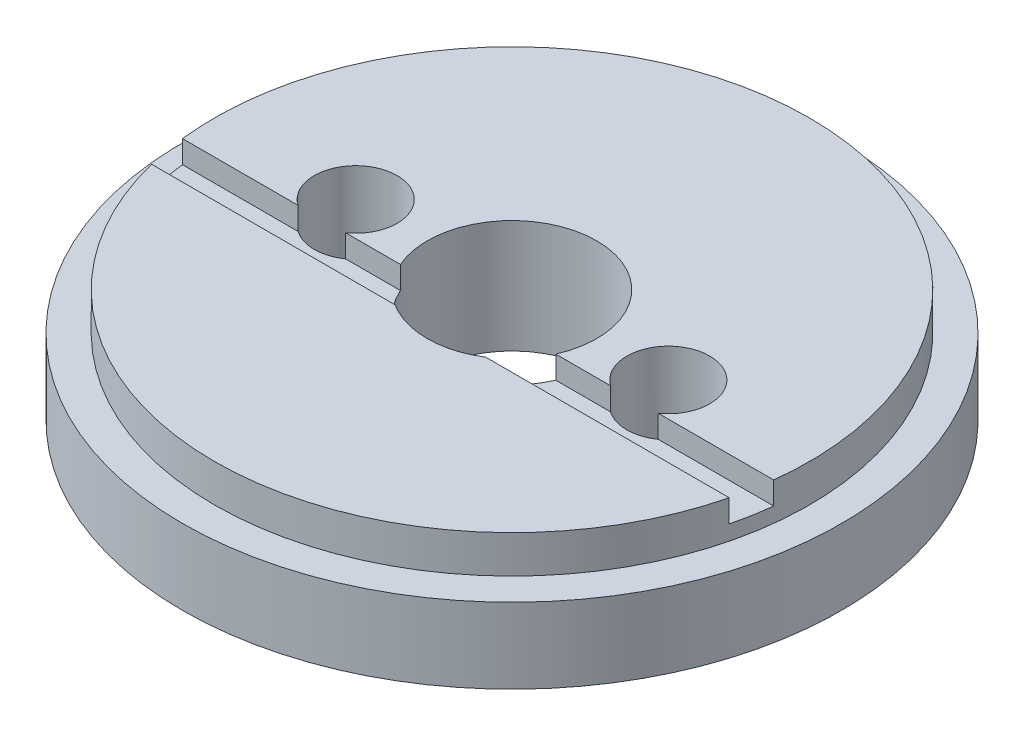
from build123d import *

# Parameters (mm, degrees)
SKETCH2_R           = 17.5
SKETCH2_R_2         = 4.5
SKETCH2_R_3         = 2.2
BOSS_EXTRUDE2_DEPTH = 6
SKETCH3_OUTSIDE_W   = 46.972
SKETCH3_OUTSIDE_H   = 46.972
SKETCH3_OUTSIDE_R   = 15.8
CUT_EXTRUDE1_DEPTH  = 2
CUT_EXTRUDE3_START  = -1.2
CUT_EXTRUDE3_DEPTH  = 1.2


with BuildPart() as part:
    # Sketch2 → Boss-Extrude2 (new body)
    with BuildSketch(Plane(origin=(0, 0, 0), x_dir=(1, 0, 0), z_dir=(0, 1, 0))):
        with Locations(Location((0, 0, 0), (0, 0, 270))):
            Circle(SKETCH2_R)
        with Locations(Location((0, 0, 0), (0, 0, 270))):
            Circle(SKETCH2_R_2, mode=Mode.SUBTRACT)
        with Locations(Location((-8.3, 0, 0), (0, 0, 270))):
            Circle(SKETCH2_R_3, mode=Mode.SUBTRACT)
        with Locations(Location((8.3, 0, 0), (0, 0, 90))):
            Circle(SKETCH2_R_3, mode=Mode.SUBTRACT)
    extrude(amount=BOSS_EXTRUDE2_DEPTH)

    # Sketch3 outside → Cut-Extrude1 (cut)
    with BuildSketch(Plane(origin=(0, 6, 0), x_dir=(1, 0, 0), z_dir=(0, 1, 0))):
        Rectangle(SKETCH3_OUTSIDE_W, SKETCH3_OUTSIDE_H)
        with Locations(Location((0, 0, 0), (0, 0, 270))):
            Circle(SKETCH3_OUTSIDE_R, mode=Mode.SUBTRACT)
    extrude(amount=-CUT_EXTRUDE1_DEPTH, mode=Mode.SUBTRACT)

    # Sketch4 → Cut-Extrude3 (cut)
    with BuildSketch(Plane(origin=(0, 6, 0), x_dir=(1, 0, 0), z_dir=(0, 1, 0)).offset(CUT_EXTRUDE3_START)):
        with BuildLine():
            Line((-9.564911064, -1.8), (-15.697133496, -1.8))
            ThreePointArc((-15.697133496, -1.8), (-15.548872546, -2.805808715), (-15.33623161, -3.8))
            Line((-15.33623161, -3.8), (-2.410394159, -3.8))
            ThreePointArc((-2.410394159, -3.8), (-3.416960076, -2.928204884), (-4.124318125, -1.8))
            Line((-4.124318125, -1.8), (-7.035088936, -1.8))
            ThreePointArc((-7.035088936, -1.8), (-8.3, -2.2), (-9.564911064, -1.8))
        make_face()
        with BuildLine():
            ThreePointArc((15.33623161, -3.8), (15.548872546, -2.805808715), (15.697133496, -1.8))
            Line((15.697133496, -1.8), (9.564911064, -1.8))
            ThreePointArc((9.564911064, -1.8), (8.3, -2.2), (7.035088936, -1.8))
            Line((7.035088936, -1.8), (4.124318125, -1.8))
            ThreePointArc((4.124318125, -1.8), (3.416960076, -2.928204884), (2.410394159, -3.8))
            Line((2.410394159, -3.8), (15.33623161, -3.8))
        make_face()
    extrude(amount=CUT_EXTRUDE3_DEPTH, mode=Mode.SUBTRACT)


solid = part.part
